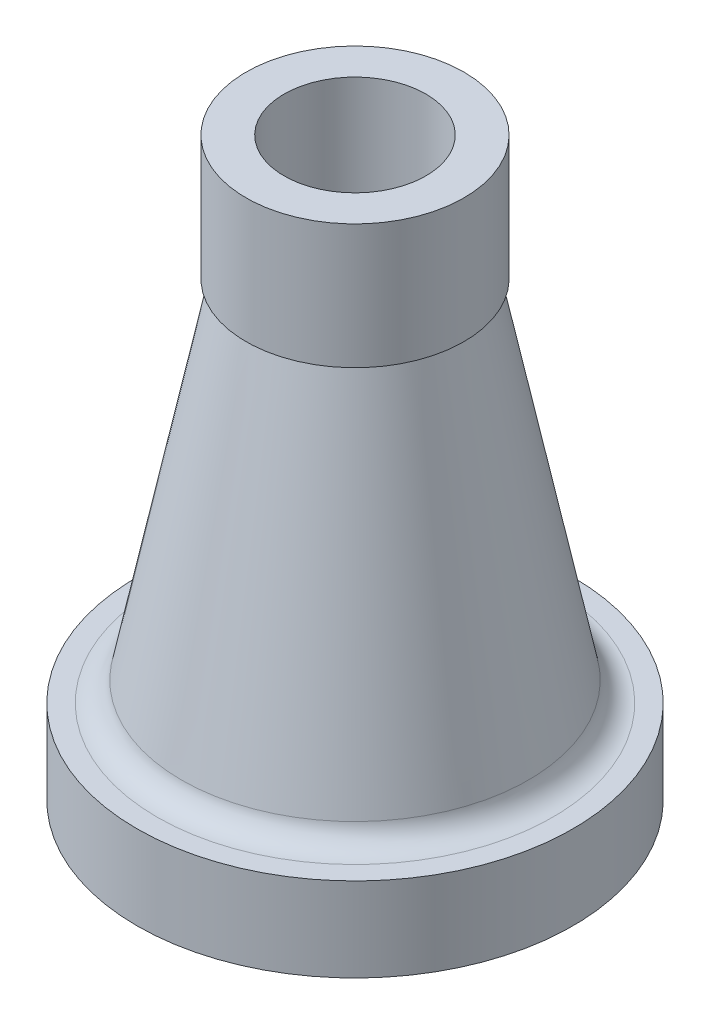
from build123d import *


with BuildPart() as part:
    # Sketch1 → Revolve1 (revolve)
    with BuildSketch(Plane.XY, mode=Mode.PRIVATE) as revolve1_sk:
        with BuildLine():
            Line((-70, 0), (-70, 27))
            Line((-70, 27), (-63.536674291, 27))
            ThreePointArc((-63.536674291, 27), (-58.474845852, 28.805010666), (-55.697180993, 33.405526787))
            Line((-55.697180993, 33.405526787), (-33, 145))
            Line((-33, 145), (-35, 145))
            Line((-35, 145), (-35, 185))
            Line((-35, 185), (-22.784683939, 185))
            Line((-22.784683939, 185), (-22.784683939, 130))
            Line((-22.784683939, 130), (-47.598243261, 8))
            Line((-47.598243261, 8), (-50, 8))
            Line((-50, 8), (-50, 0))
            Line((-50, 0), (-70, 0))
        make_face()
    revolve(revolve1_sk.sketch.rotate(Axis((0, 0, 0), (0, 1, 0)), 270), axis=Axis((0, 0, 0), (0, 1, 0)))


solid = part.part
